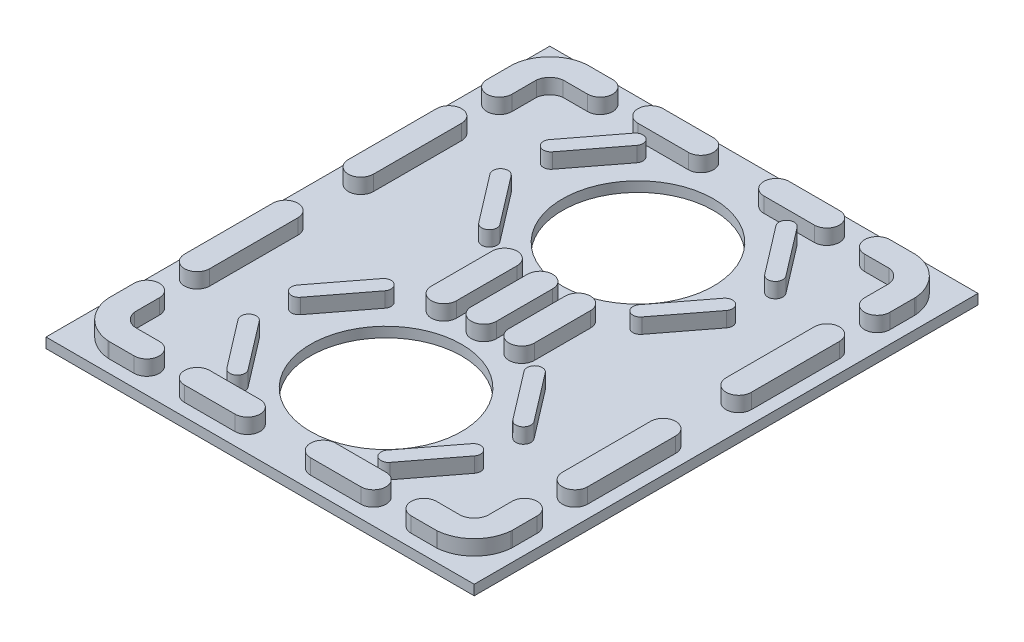
from build123d import *

# Parameters (mm, degrees)
SKETCH1_W               = 170
SKETCH1_H               = 200
BOSS_EXTRUDE1_DEPTH     = 4
BOSS_EXTRUDE2_DEPTH     = 6
CUT_EXTRUDE2_DEPTH      = 263.678510731
CUT_EXTRUDE2_DEPTH_BACK = 10
SKETCH4_R               = 30


with BuildPart() as part:
    # Sketch1 → Boss-Extrude1 (new body)
    with BuildSketch(Plane(origin=(0, 0, 0), x_dir=(1, 0, 0), z_dir=(0, 1, 0))):
        with Locations((85, 100)):
            Rectangle(SKETCH1_W, SKETCH1_H)
    extrude(amount=BOSS_EXTRUDE1_DEPTH)

    # Sketch3 → Boss-Extrude2 (add)
    with BuildSketch(Plane(origin=(0, 4, 0), x_dir=(1, 0, 0), z_dir=(0, 1, 0))):
        with BuildLine():
            Line((30, 15), (20.262068061, 15))
            ThreePointArc((20.262068061, 15), (16.735494747, 16.716132106), (15, 20.233217082))
            Line((15, 20.233217082), (15, 30))
            ThreePointArc((15, 30), (10, 35), (5, 30))
            Line((5, 30), (5, 20))
            Line((5, 20), (4.996202412, 20))
            ThreePointArc((4.996202412, 20), (5.001432837, 19.771358596), (5.017113168, 19.54319555))
            ThreePointArc((5.017113168, 19.54319555), (9.654794827, 9.654664453), (19.545086076, 5.020737673))
            ThreePointArc((19.545086076, 5.020737673), (19.772306824, 5.005187109), (20, 5))
            Line((20, 5), (30, 5))
            ThreePointArc((30, 5), (35, 10), (30, 15))
        make_face()
        with BuildLine():
            Line((5, 85), (5, 50))
            ThreePointArc((5, 50), (10, 45), (15, 50))
            Line((15, 50), (15, 85))
            ThreePointArc((15, 85), (10, 90), (5, 85))
        make_face()
        with BuildLine():
            Line((70, 15), (50, 15))
            ThreePointArc((50, 15), (45, 10), (50, 5))
            Line((50, 5), (70, 5))
            ThreePointArc((70, 5), (75, 10), (70, 15))
        make_face()
        with BuildLine():
            ThreePointArc((155, 50), (160, 45), (165, 50))
            Line((165, 50), (165, 85))
            ThreePointArc((165, 85), (160, 90), (155, 85))
            Line((155, 85), (155, 50))
        make_face()
        with BuildLine():
            ThreePointArc((155, 20.233217082), (153.264505253, 16.716132106), (149.737931939, 15))
            Line((149.737931939, 15), (140, 15))
            ThreePointArc((140, 15), (135, 10), (140, 5))
            Line((140, 5), (150, 5))
            ThreePointArc((150, 5), (150.227693176, 5.005187109), (150.454913924, 5.020737673))
            ThreePointArc((150.454913924, 5.020737673), (160.345205173, 9.654664453), (164.982886832, 19.54319555))
            ThreePointArc((164.982886832, 19.54319555), (165.002074296, 19.868737095), (165, 20.194837008))
            Line((165, 20.194837008), (165, 30))
            ThreePointArc((165, 30), (160, 35), (155, 30))
            Line((155, 30), (155, 20.233217082))
        make_face()
        with BuildLine():
            ThreePointArc((120, 5), (125, 10), (120, 15))
            Line((120, 15), (100, 15))
            ThreePointArc((100, 15), (95, 10), (100, 5))
            Line((100, 5), (120, 5))
        make_face()
        with BuildLine():
            Line((165, 115), (165, 150))
            ThreePointArc((165, 150), (160, 155), (155, 150))
            Line((155, 150), (155, 115))
            ThreePointArc((155, 115), (160, 110), (165, 115))
        make_face()
        with BuildLine():
            Line((155, 179.766782918), (155, 170))
            ThreePointArc((155, 170), (160, 165), (165, 170))
            Line((165, 170), (165, 179.805162992))
            ThreePointArc((165, 179.805162992), (165.002074296, 180.131262905), (164.982886832, 180.45680445))
            ThreePointArc((164.982886832, 180.45680445), (160.345205173, 190.345335547), (150.454913924, 194.979262327))
            ThreePointArc((150.454913924, 194.979262327), (150.227693176, 194.994812891), (150, 195))
            Line((150, 195), (140, 195))
            ThreePointArc((140, 195), (135, 190), (140, 185))
            Line((140, 185), (149.737931939, 185))
            ThreePointArc((149.737931939, 185), (153.264505253, 183.283867894), (155, 179.766782918))
        make_face()
        with BuildLine():
            Line((100, 185), (120, 185))
            ThreePointArc((120, 185), (125, 190), (120, 195))
            Line((120, 195), (100, 195))
            ThreePointArc((100, 195), (95, 190), (100, 185))
        make_face()
        with BuildLine():
            ThreePointArc((50, 195), (45, 190), (50, 185))
            Line((50, 185), (70, 185))
            ThreePointArc((70, 185), (75, 190), (70, 195))
            Line((70, 195), (50, 195))
        make_face()
        with BuildLine():
            ThreePointArc((20, 195), (19.772306824, 194.994812891), (19.545086076, 194.979262327))
            ThreePointArc((19.545086076, 194.979262327), (9.654794827, 190.345335547), (5.017113168, 180.45680445))
            ThreePointArc((5.017113168, 180.45680445), (4.997925704, 180.131262905), (5, 179.805162992))
            Line((5, 179.805162992), (5, 170))
            ThreePointArc((5, 170), (10, 165), (15, 170))
            Line((15, 170), (15, 179.766782918))
            ThreePointArc((15, 179.766782918), (16.735494747, 183.283867894), (20.262068061, 185))
            Line((20.262068061, 185), (30, 185))
            ThreePointArc((30, 185), (35, 190), (30, 195))
            Line((30, 195), (20, 195))
        make_face()
        with BuildLine():
            ThreePointArc((15, 150), (10, 155), (5, 150))
            Line((5, 150), (5, 115))
            ThreePointArc((5, 115), (10, 110), (15, 115))
            Line((15, 115), (15, 150))
        make_face()
        with BuildLine():
            Line((90, 88.83925215), (90, 111.16074785))
            ThreePointArc((90, 111.16074785), (85, 116.16074785), (80, 111.16074785))
            Line((80, 111.16074785), (80, 88.83925215))
            ThreePointArc((80, 88.83925215), (85, 83.83925215), (90, 88.83925215))
        make_face()
        with BuildLine():
            Line((75, 87.963108376), (75, 112.036891624))
            ThreePointArc((75, 112.036891624), (70, 117.036891624), (65, 112.036891624))
            Line((65, 112.036891624), (65, 87.963108376))
            ThreePointArc((65, 87.963108376), (70, 82.963108376), (75, 87.963108376))
        make_face()
        with BuildLine():
            Line((105, 88.843049738), (105, 111.156950262))
            ThreePointArc((105, 111.156950262), (100, 116.156950262), (95, 111.156950262))
            Line((95, 111.156950262), (95, 88.843049738))
            ThreePointArc((95, 88.843049738), (100, 83.843049738), (105, 88.843049738))
        make_face()
        with BuildLine():
            Line((57.382246702, 22.829681435), (42.843957296, 41.823431011))
            ThreePointArc((42.843957296, 41.823431011), (38.638279583, 42.382246702), (38.079463892, 38.176568989))
            Line((38.079463892, 38.176568989), (52.617753298, 19.182819413))
            ThreePointArc((52.617753298, 19.182819413), (56.823431011, 18.624003722), (57.382246702, 22.829681435))
        make_face()
        with BuildLine():
            ThreePointArc((131.920536108, 38.176568989), (131.361720417, 42.382246702), (127.156042704, 41.823431011))
            Line((127.156042704, 41.823431011), (112.617753298, 22.829681435))
            ThreePointArc((112.617753298, 22.829681435), (113.176568989, 18.624003722), (117.382246702, 19.182819413))
            Line((117.382246702, 19.182819413), (131.920536108, 38.176568989))
        make_face()
        with BuildLine():
            Line((112.617753298, 77.170318565), (127.156042704, 58.176568989))
            ThreePointArc((127.156042704, 58.176568989), (131.361720417, 57.617753298), (131.920536108, 61.823431011))
            Line((131.920536108, 61.823431011), (117.382246702, 80.817180587))
            ThreePointArc((117.382246702, 80.817180587), (113.176568989, 81.375996278), (112.617753298, 77.170318565))
        make_face()
        with BuildLine():
            ThreePointArc((38.079463892, 61.823431011), (38.638279583, 57.617753298), (42.843957296, 58.176568989))
            Line((42.843957296, 58.176568989), (57.382246702, 77.170318565))
            ThreePointArc((57.382246702, 77.170318565), (56.823431011, 81.375996278), (52.617753298, 80.817180587))
            Line((52.617753298, 80.817180587), (38.079463892, 61.823431011))
        make_face()
        with BuildLine():
            ThreePointArc((38.079463892, 161.823431011), (38.638279583, 157.617753298), (42.843957296, 158.176568989))
            Line((42.843957296, 158.176568989), (57.382246702, 177.170318565))
            ThreePointArc((57.382246702, 177.170318565), (56.823431011, 181.375996278), (52.617753298, 180.817180587))
            Line((52.617753298, 180.817180587), (38.079463892, 161.823431011))
        make_face()
        with BuildLine():
            Line((112.617753298, 177.170318565), (127.156042704, 158.176568989))
            ThreePointArc((127.156042704, 158.176568989), (131.361720417, 157.617753298), (131.920536108, 161.823431011))
            Line((131.920536108, 161.823431011), (117.382246702, 180.817180587))
            ThreePointArc((117.382246702, 180.817180587), (113.176568989, 181.375996278), (112.617753298, 177.170318565))
        make_face()
        with BuildLine():
            ThreePointArc((131.920536108, 138.176568989), (131.361720417, 142.382246702), (127.156042704, 141.823431011))
            Line((127.156042704, 141.823431011), (112.617753298, 122.829681435))
            ThreePointArc((112.617753298, 122.829681435), (113.176568989, 118.624003722), (117.382246702, 119.182819413))
            Line((117.382246702, 119.182819413), (131.920536108, 138.176568989))
        make_face()
        with BuildLine():
            Line((57.382246702, 122.829681435), (42.843957296, 141.823431011))
            ThreePointArc((42.843957296, 141.823431011), (38.638279583, 142.382246702), (38.079463892, 138.176568989))
            Line((38.079463892, 138.176568989), (52.617753298, 119.182819413))
            ThreePointArc((52.617753298, 119.182819413), (56.823431011, 118.624003722), (57.382246702, 122.829681435))
        make_face()
    extrude(amount=BOSS_EXTRUDE2_DEPTH)

    # Sketch4 → Cut-Extrude2 (cut, two sides: drawn at the far end of the back side and taken through both)
    with BuildSketch(Plane(origin=(0, 0, 0), x_dir=(1, 0, 0), z_dir=(0, 1, 0)).offset(-CUT_EXTRUDE2_DEPTH_BACK)):
        with Locations(Location((85, 50, 0), (0, 0, 90))):
            Circle(SKETCH4_R)
        with Locations(Location((85, 150, 0), (0, 0, 90))):
            Circle(SKETCH4_R)
    extrude(amount=CUT_EXTRUDE2_DEPTH + CUT_EXTRUDE2_DEPTH_BACK, mode=Mode.SUBTRACT)


solid = part.part
